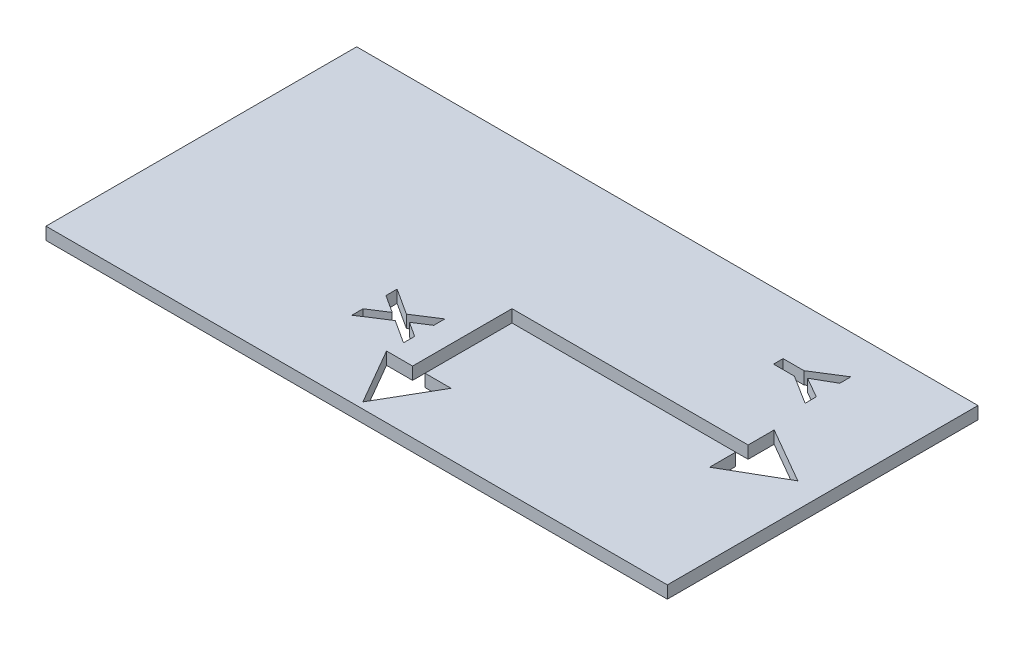
from build123d import *

# Parameters (mm, degrees)
SKETCH_2_W          = 25
SKETCH_2_H          = 50
EXTRUDE_2_DEPTH     = 1
CUT_EXTRUDE_3_DEPTH = 8
EXTRUDE_4_DEPTH     = 16
EXTRUDE_4_2_DEPTH   = 16
MOVE_BODY_1_ANGLE   = 120
SCALE_1_SCALE       = 0.02


with BuildPart() as part:
    # Эскиз2 → Бобышка-Вытянуть2 (new body)
    with BuildSketch(Plane.XY):
        Rectangle(SKETCH_2_W, SKETCH_2_H)
    extrude(amount=EXTRUDE_2_DEPTH)

    # Эскиз6 → Вырез-Вытянуть3 (cut)
    with BuildSketch(Plane.XY.offset(1)):
        Polygon((-2.598076211, 18.5), (2.598076211, 18.5), (0, 23), align=None)
        Polygon((7.5, -0.5), (7.5, 0.5), (0.5, 0.5), (0.5, 18.5), (-0.5, 18.5), (-0.5, -0.5), align=None)
        Polygon((7.5, 2.598076211), (7.5, -2.598076211), (12, 0), align=None)
    extrude(amount=-CUT_EXTRUDE_3_DEPTH, mode=Mode.SUBTRACT)


with BuildPart() as body_2:
    # Эскиз7 → Бобышка-Вытянуть4 (new body)
    with BuildSketch(Plane.XY.offset(1)):
        Polygon((-7.927565688, 13.889018638), (-7.927565688, 15.572512228), (-9.389104149, 17.889018638), (-8.489264406, 17.889018638), (-7.543751585, 16.240781459), (-6.5966362, 17.889018638), (-5.696796457, 17.889018638), (-7.158334918, 15.566903254), (-7.158334918, 13.889018638), align=None)
    extrude(amount=-EXTRUDE_4_DEPTH)


with BuildPart() as body_3:
    # Эскиз7 → Extrude 4 2 (new body)
    with BuildSketch(Plane.XY.offset(1)):
        Polygon((2.759563021, -6.485396961), (4.130556611, -4.366807217), (2.913409175, -2.485396961), (3.812447637, -2.485396961), (4.580075842, -3.672095679), (5.347704047, -2.485396961), (6.246742508, -2.485396961), (5.029595073, -4.366807217), (6.400588662, -6.485396961), (5.501550201, -6.485396961), (4.580075842, -5.061518755), (3.658601483, -6.485396961), align=None)
    extrude(amount=-EXTRUDE_4_2_DEPTH)


with BuildPart() as part_1:
    add(part.part)

    # Combine 1: cut body 2, body 3
    add(body_2.part, mode=Mode.SUBTRACT)
    add(body_3.part, mode=Mode.SUBTRACT)


with BuildPart() as part_2:
    # Move Body 1: moved
    add(part_1.part.moved(Location((0, 0, 0))).rotate(Axis((-0.166666667, -0.166666667, 0.333333333), (-0.577350269189609, -0.5773502691897541, -0.5773502691895143)), MOVE_BODY_1_ANGLE))


with BuildPart() as part_3:
    # Масштаб1: scaled about (0, 0, 0)
    add(part_2.part.scale(SCALE_1_SCALE))


solid = part_3.part
